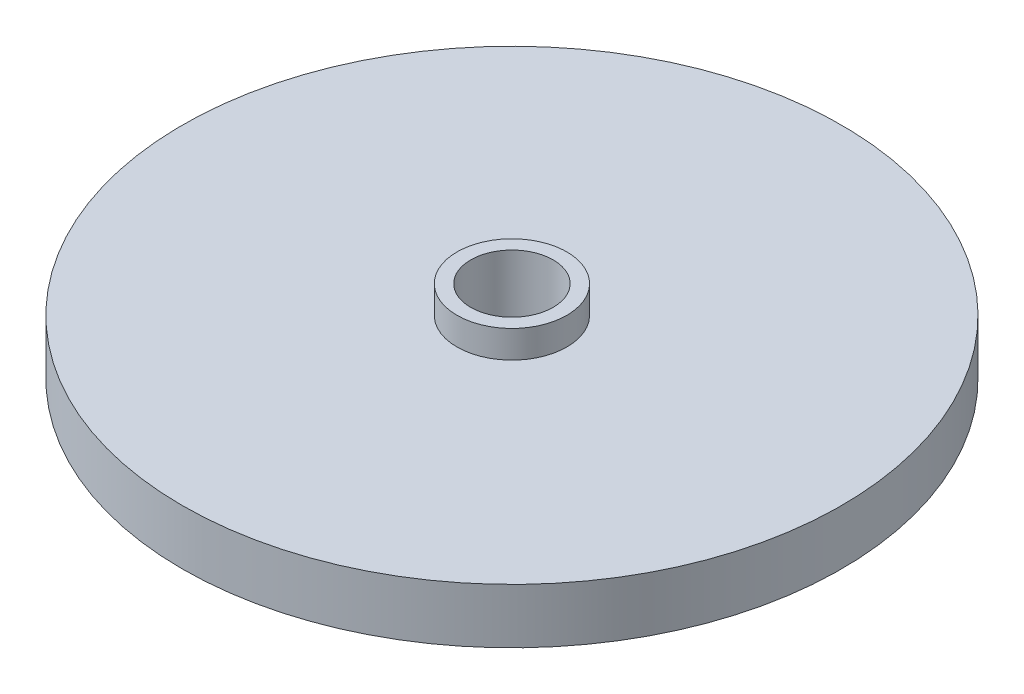
from build123d import *

# Parameters (mm, degrees)
SKETCH1_R           = 12
BOSS_EXTRUDE1_DEPTH = 2
SKETCH2_R           = 4.5
BOSS_EXTRUDE2_DEPTH = 2
SKETCH3_R           = 1.5
CUT_EXTRUDE1_DEPTH  = 18.435595774
SKETCH4_R           = 2
SKETCH4_R_2         = 1.5
BOSS_EXTRUDE3_DEPTH = 1


with BuildPart() as part:
    # Sketch1 → Boss-Extrude1 (new body)
    with BuildSketch(Plane(origin=(0, 0, 0), x_dir=(1, 0, 0), z_dir=(0, 1, 0))):
        with Locations(Location((0, 0, 0), (0, 0, 270))):
            Circle(SKETCH1_R)
    extrude(amount=-BOSS_EXTRUDE1_DEPTH)

    # Sketch2 → Boss-Extrude2 (add)
    with BuildSketch(Plane.XZ.offset(2)):
        with Locations(Location((0, 0, 0), (0, 0, 270))):
            Circle(SKETCH2_R)
    extrude(amount=BOSS_EXTRUDE2_DEPTH)

    # Sketch3 → Cut-Extrude1 (cut, through all)
    with BuildSketch(Plane.XZ.offset(4)):
        with Locations(Location((0, 0, 0), (0, 0, 270))):
            Circle(SKETCH3_R)
    extrude(amount=-CUT_EXTRUDE1_DEPTH, mode=Mode.SUBTRACT)

    # Sketch4 → Boss-Extrude3 (add)
    with BuildSketch(Plane(origin=(0, 0, 0), x_dir=(1, 0, 0), z_dir=(0, 1, 0))):
        with Locations(Location((0, 0, 0), (0, 0, 270))):
            Circle(SKETCH4_R)
        with Locations(Location((0, 0, 0), (0, 0, 90))):
            Circle(SKETCH4_R_2, mode=Mode.SUBTRACT)
    extrude(amount=BOSS_EXTRUDE3_DEPTH)


solid = part.part
